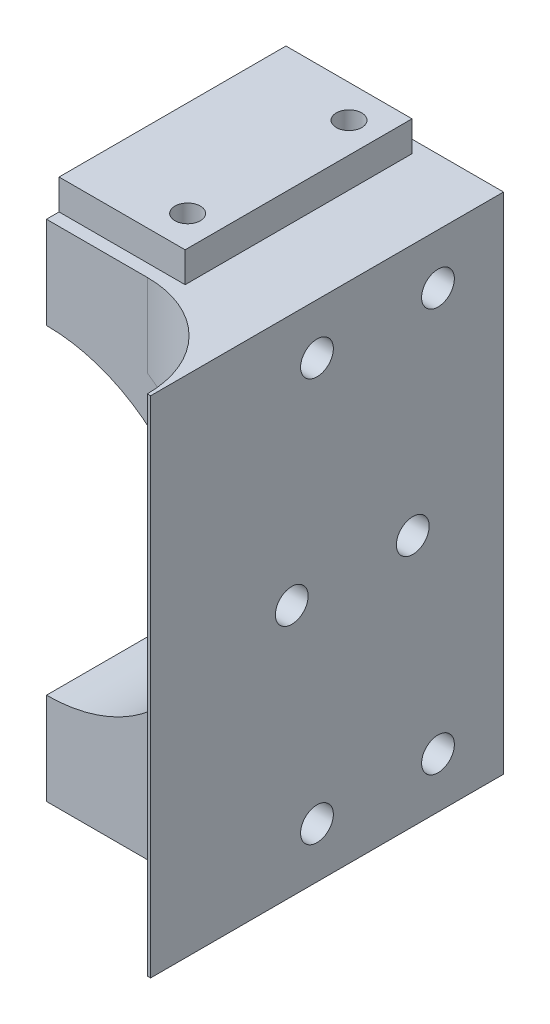
from build123d import *

# Parameters (mm, degrees)
CENTRE_HOLE_FOR_L2_DEPTH      = 40
CENTRE_HOLE_FOR_L2_DEPTH_BACK = 10
SKETCH1_R                     = 39.1
SKETCH1_R_2                   = 31.75
MAIN_STRUCTURE_DEPTH          = 60
MAIN_STRUCTURE_DEPTH_BACK     = 50
SKETCH2_W                     = 100
SKETCH2_H                     = 100
SKETCH2_R                     = 39.1
BEARING_CURVE_DEPTH           = 10
SKETCH6_R                     = 10.5
SHAFT_HOLE_DEPTH              = 10
WRIST_CUTOUT_DEPTH            = 188.082869339
SKETCH11_W                    = 25
SKETCH11_H                    = 45
SKETCH11_R                    = 2.525
BOSS_EXTRUDE1_DEPTH           = 6
CUT_EXTRUDE6_DEPTH            = 168.73789077
CUT_EXTRUDE6_DEPTH_BACK       = 168.73789077
SKETCH18_R                    = 3.25
CUT_EXTRUDE7_START            = -1.5875
CUT_EXTRUDE7_DEPTH            = 1.5875
SKETCH9_R                     = 12.05
BEARING_DEPTH                 = 5
CUT_EXTRUDE8_DEPTH            = 3
SKETCH21_R                    = 3.25
SKETCH21_R_2                  = 1.65
CUT_EXTRUDE9_DEPTH            = 167.868211501
CUT_EXTRUDE10_DEPTH           = 6.35
SKETCH23_R                    = 2.275
CUT_EXTRUDE11_DEPTH           = 6
CHAMFER1_SIZE                 = 0.5


with BuildPart() as part:
    # Sketch1 → Centre Hole for L2 (new, two sides: drawn at the far end of the back side and taken through both)
    with BuildSketch(Plane.XY.offset(-CENTRE_HOLE_FOR_L2_DEPTH_BACK)):
        Circle(SKETCH1_R)
        Circle(SKETCH1_R_2, mode=Mode.SUBTRACT)
    extrude(amount=CENTRE_HOLE_FOR_L2_DEPTH + CENTRE_HOLE_FOR_L2_DEPTH_BACK)

    # Sketch2 → Main Structure (add, two sides: drawn at the far end of the back side and taken through both)
    with BuildSketch(Plane.XY.offset(40).offset(-MAIN_STRUCTURE_DEPTH_BACK)):
        Rectangle(SKETCH2_W, SKETCH2_H)
        Circle(SKETCH2_R, mode=Mode.SUBTRACT)
    extrude(amount=MAIN_STRUCTURE_DEPTH + MAIN_STRUCTURE_DEPTH_BACK)

    # Sketch3 → Bearing Curve (add)
    with BuildSketch(Plane.ZY.offset(50)):
        with BuildLine():
            Line((100, 50), (100, -50))
            ThreePointArc((100, -50), (150, 0), (100, 50))
        make_face()
    bearing_curve = extrude(amount=-BEARING_CURVE_DEPTH)

    # Upright Mirror: Bearing Curve across plane
    add(bearing_curve.mirror(Plane(origin=(0, 0, 0), x_dir=(0, 0, 1), z_dir=(1, 0, 0))))

    # Sketch6 → Shaft Hole (cut)
    with BuildSketch(Plane.ZY.offset(50)):
        with Locations((100, 0)):
            Circle(SKETCH6_R)
    extrude(amount=-SHAFT_HOLE_DEPTH, mode=Mode.SUBTRACT)

    # Sketch4 → Wrist Cutout (cut, through all)
    with BuildSketch(Plane(origin=(0, 50, 0), x_dir=(1, 0, 0), z_dir=(0, 1, 0))):
        with BuildLine():
            Line((-40, -100), (-40, -60))
            ThreePointArc((-40, -60), (-34.142135624, -45.857864376), (-20, -40))
            Line((-20, -40), (20, -40))
            ThreePointArc((20, -40), (34.142135624, -45.857864376), (40, -60))
            Line((40, -60), (40, -100))
            Line((40, -100), (-40, -100))
        make_face()
    extrude(amount=-WRIST_CUTOUT_DEPTH, mode=Mode.SUBTRACT)

    # SurfaceCut1
    split(bisect_by=Plane.ZY, keep=Keep.TOP)

    # Sketch11 → Boss-Extrude1 (add)
    with BuildSketch(Plane(origin=(0, 50, 0), x_dir=(1, 0, 0), z_dir=(0, 1, 0))):
        with Locations((-12.5, -15)):
            Rectangle(SKETCH11_W, SKETCH11_H)
        with Locations(Location((-19, 1, 0), (0, 0, 270))):
            Circle(SKETCH11_R, mode=Mode.SUBTRACT)
        with Locations(Location((-19, -31, 0), (0, 0, 270))):
            Circle(SKETCH11_R, mode=Mode.SUBTRACT)
    extrude(amount=BOSS_EXTRUDE1_DEPTH)

    # Sketch18 → Cut-Extrude6 (cut, two sides: drawn at the far end of the back side and taken through both)
    with BuildSketch(Plane.ZY.offset(50).offset(-CUT_EXTRUDE6_DEPTH_BACK)):
        with Locations((8, 0)):
            Circle(SKETCH18_R)
        with Locations((32, 0)):
            Circle(SKETCH18_R)
    extrude(amount=CUT_EXTRUDE6_DEPTH + CUT_EXTRUDE6_DEPTH_BACK, mode=Mode.SUBTRACT)

    # Sketch19 → Cut-Extrude7 (cut)
    with BuildSketch(Plane(origin=(-40, 0, 0), x_dir=(0, 0, -1), z_dir=(1, 0, 0)).offset(CUT_EXTRUDE7_START)):
        with BuildLine():
            Line((-60, 50), (-100, 50))
            ThreePointArc((-100, 50), (-150, 0), (-100, -50))
            Line((-100, -50), (-60, -50))
            Line((-60, -50), (-60, 50))
        make_face()
    extrude(amount=CUT_EXTRUDE7_DEPTH, mode=Mode.SUBTRACT)

    # Sketch9 → Bearing (cut)
    with BuildSketch(Plane(origin=(-41.5875, 0, 0), x_dir=(0, 0, -1), z_dir=(1, 0, 0))):
        with Locations((-100, 0)):
            Circle(SKETCH9_R)
    extrude(amount=-BEARING_DEPTH, mode=Mode.SUBTRACT)

    # Sketch20 → Cut-Extrude8 (cut)
    with BuildSketch(Plane.ZY.offset(50)):
        with BuildLine():
            Line((-10, -50), (100, -50))
            ThreePointArc((100, -50), (150, 0), (100, 50))
            Line((100, 50), (-10, 50))
            Line((-10, 50), (-10, -50))
        make_face()
    extrude(amount=-CUT_EXTRUDE8_DEPTH, mode=Mode.SUBTRACT)

    # Sketch21 → Cut-Extrude9 (cut, through all)
    with BuildSketch(Plane.ZY.offset(47)):
        with Locations((3, -40)):
            Circle(SKETCH21_R)
        with Locations((27, -40)):
            Circle(SKETCH21_R)
        with Locations(Location((27, 40, 0), (0, 0, 180))):
            Circle(SKETCH21_R)
        with Locations(Location((3, 40, 0), (0, 0, 180))):
            Circle(SKETCH21_R)
        with Locations((125, 0)):
            Circle(SKETCH21_R_2)
    extrude(amount=-CUT_EXTRUDE9_DEPTH, mode=Mode.SUBTRACT)

    # Sketch22 → Cut-Extrude10 (cut)
    with BuildSketch(Plane.ZY.offset(47)):
        with BuildLine():
            Line((-10, 50), (-10, -50))
            Line((-10, -50), (100, -50))
            ThreePointArc((100, -50), (150, 0), (100, 50))
            Line((100, 50), (-10, 50))
        make_face()
    extrude(amount=-CUT_EXTRUDE10_DEPTH, mode=Mode.SUBTRACT)

    # Sketch23 → Cut-Extrude11 (cut)
    with BuildSketch(Plane(origin=(0, -50, 0), x_dir=(-1, 0, 0), z_dir=(0, -1, 0))):
        with Locations(Location((15, 3.25, 0), (0, 0, 90))):
            Circle(SKETCH23_R)
    extrude(amount=-CUT_EXTRUDE11_DEPTH, mode=Mode.SUBTRACT)

    # Chamfer1
    chamfer1_edges = [part.edges().sort_by_distance(p)[0] for p in [
        (-15, -50, -0.975),
    ]]
    chamfer(chamfer1_edges, length=CHAMFER1_SIZE)


with BuildPart() as body_2:
    # Mirror1: mirrored copy
    add(part.part.mirror(Plane.ZY))


solid = body_2.part
